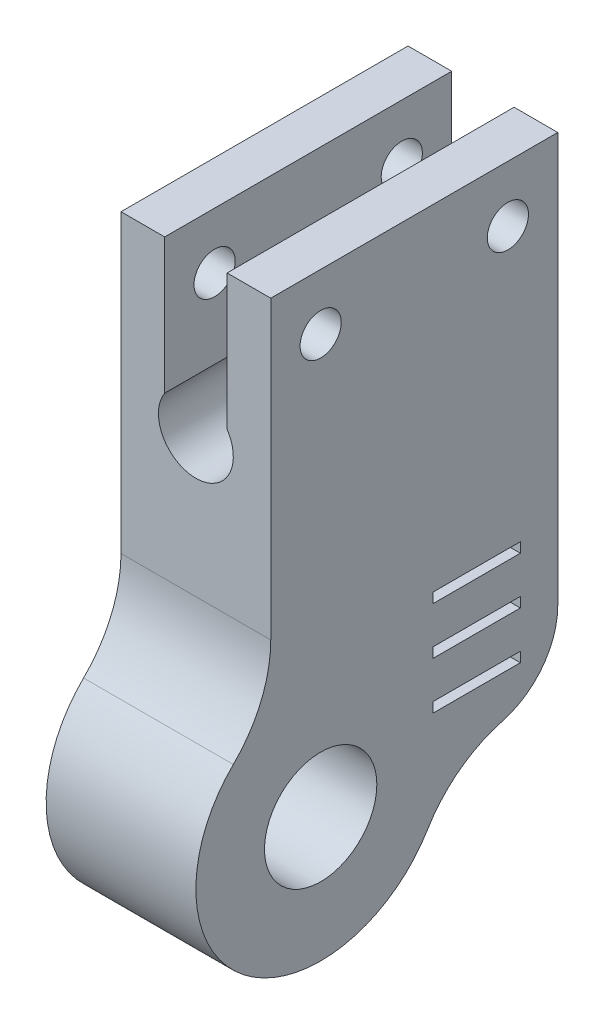
from build123d import *

# Parameters (mm, degrees)
SKIZZE1_R                       = 1.65
SKIZZE1_R_2                     = 4.5
SKIZZE1_W                       = 7
SKIZZE1_H                       = 0.8
AUFSATZ_LINEAR_AUSTRAGEN1_DEPTH = 12
SCHNITT_LINEAR_AUSTRAGEN2_DEPTH = 47.258945081
SCHNITT_LINEAR_AUSTRAGEN4_DEPTH = 5
VERRUNDUNG1_R                   = 10
VERRUNDUNG3_R                   = 6


with BuildPart() as part:
    # Skizze1 → Aufsatz-Linear austragen1 (new body)
    with BuildSketch(Plane(origin=(0, 0, 0), x_dir=(0, 0, -1), z_dir=(1, 0, 0))):
        with BuildLine():
            Line((13.995498987, 0), (23, 0))
            Line((23, 0), (23, 38.3))
            Line((23, 38.3), (0, 38.3))
            Line((0, 38.3), (0, 9.46515139))
            ThreePointArc((0, 9.46515139), (-1.602122342, -7.983491128), (13.995498987, 0))
        make_face()
        with Locations((4, 33.8)):
            Circle(SKIZZE1_R, mode=Mode.SUBTRACT)
        with Locations((19, 33.8)):
            Circle(SKIZZE1_R, mode=Mode.SUBTRACT)
        with Locations((4, 0.3)):
            Circle(SKIZZE1_R_2, mode=Mode.SUBTRACT)
        with Locations((16.5, 3.4)):
            Rectangle(SKIZZE1_W, SKIZZE1_H, mode=Mode.SUBTRACT)
        with Locations((16.5, 7.2)):
            Rectangle(SKIZZE1_W, SKIZZE1_H, mode=Mode.SUBTRACT)
        with Locations((16.5, 11)):
            Rectangle(SKIZZE1_W, SKIZZE1_H, mode=Mode.SUBTRACT)
    extrude(amount=AUFSATZ_LINEAR_AUSTRAGEN1_DEPTH)

    # Skizze2 → Schnitt-Linear austragen2 (cut, through all)
    with BuildSketch(Plane.XY):
        with BuildLine():
            Line((3.5, 38.3), (8.5, 38.3))
            Line((8.5, 38.3), (8.5, 27.458312395))
            ThreePointArc((8.5, 27.458312395), (6, 22.8), (3.5, 27.458312395))
            Line((3.5, 27.458312395), (3.5, 38.3))
        make_face()
    extrude(amount=-SCHNITT_LINEAR_AUSTRAGEN2_DEPTH, mode=Mode.SUBTRACT)

    # Skizze5 → Schnitt-Linear austragen4 (cut)
    with BuildSketch(Plane(origin=(0, 0, 0), x_dir=(0, 0, -1), z_dir=(1, 0, 0))):
        Polygon((0.102885683, 7.05), (-3.794228634, 0.3), (0.102885683, -6.45), (7.897114317, -6.45), (11.794228634, 0.3), (7.897114317, 7.05), align=None)
    extrude(amount=SCHNITT_LINEAR_AUSTRAGEN4_DEPTH, mode=Mode.SUBTRACT)

    # Verrundung1
    verrundung1_edges = [part.edges().sort_by_distance(p)[0] for p in [
        (6, 0, -13.995498987),
        (6, 9.46515139, 0),
    ]]
    fillet(verrundung1_edges, radius=VERRUNDUNG1_R)

    # Verrundung3
    verrundung3_edges = [part.edges().sort_by_distance(p)[0] for p in [
        (6, 0, -23),
    ]]
    fillet(verrundung3_edges, radius=VERRUNDUNG3_R)


solid = part.part
